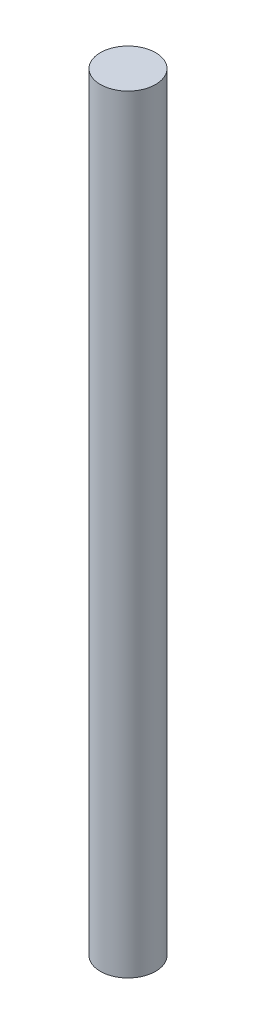
from build123d import *

# Parameters (mm, degrees)
ESBO_O1_R                = 2.45
RESSALTO_EXTRUS_O3_DEPTH = 68.13


with BuildPart() as part:
    # Esboço1 → Ressalto-extrusão3 (new body)
    with BuildSketch(Plane(origin=(0, 0, 0), x_dir=(1, 0, 0), z_dir=(0, 1, 0))):
        with Locations(Location((0, 0, 0), (0, 0, 270))):
            Circle(ESBO_O1_R)
    extrude(amount=RESSALTO_EXTRUS_O3_DEPTH)


solid = part.part
